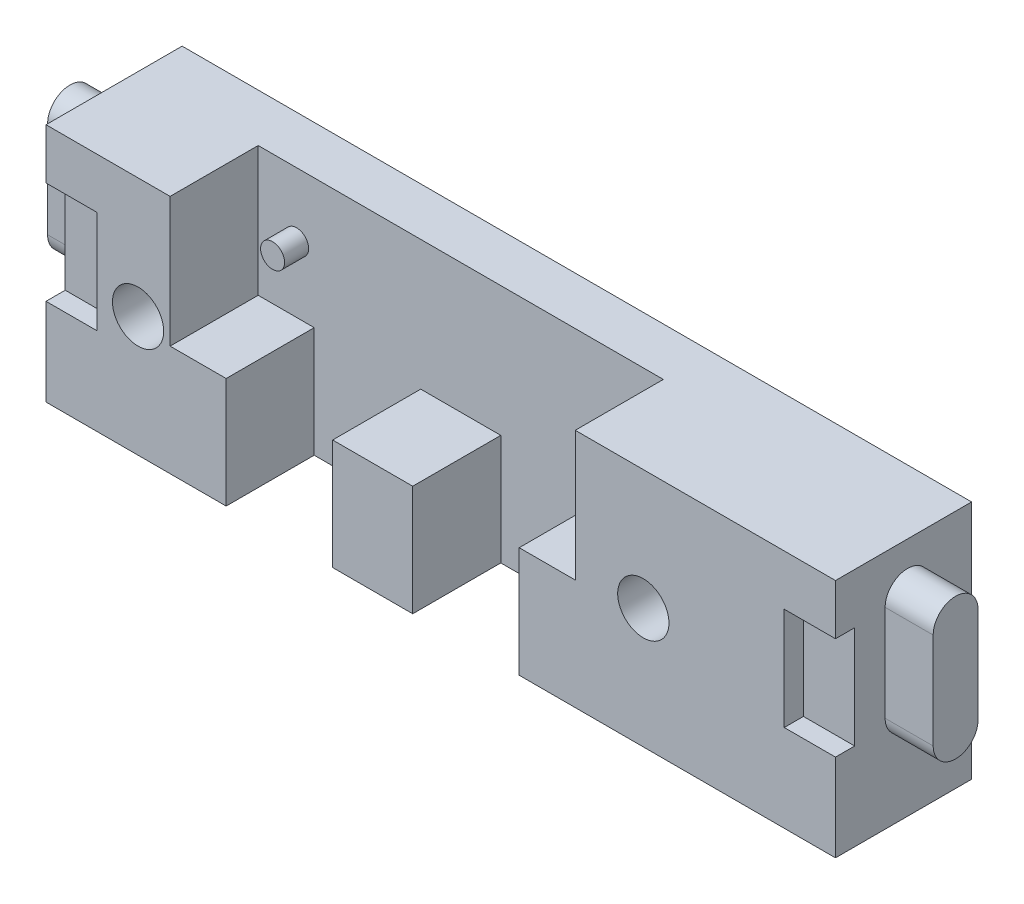
from build123d import *

# Parameters (mm, degrees)
SKETCH_1_W          = 49.3
SKETCH_1_H          = 15
EXTRUDE_1_DEPTH     = 3
SKETCH_2_W          = 5
SKETCH_2_H          = 4.567504656
SKETCH_2_H_2        = 2.332495344
EXTRUDE_2_DEPTH     = 5.5
SKETCH_3_R          = 0.75
EXTRUDE_3_DEPTH     = 1.5
SKETCH_4_R          = 1
CUT_EXTRUDE_1_DEPTH = 10
CUT_EXTRUDE_2_DEPTH = 4
EXTRUDE_4_DEPTH     = 3
SKETCH_9_R          = 1
EXTRUDE_5_DEPTH     = 4.5
EXTRUDE_9_DEPTH     = 4
SKETCH_8_R          = 1.6
CUT_EXTRUDE_3_DEPTH = 56.068502794
CUT_EXTRUDE_4_DEPTH = 2.3
SKETCH_13_W         = 3.2
SKETCH_13_H         = 6.4
CUT_EXTRUDE_5_DEPTH = 1.2


with BuildPart() as part:
    # 草图1 → 凸台-拉伸1 (new body)
    with BuildSketch(Plane.XY):
        with Locations((24.65, 7.5)):
            Rectangle(SKETCH_1_W, SKETCH_1_H)
    extrude(amount=EXTRUDE_1_DEPTH)

    # 草图2 → 凸台-拉伸2 (add)
    with BuildSketch(Plane.XY.offset(3)):
        Polygon((7.75, 6.9), (7.75, 15), (0, 15), (0, 0), (11.25, 0), (11.25, 6.9), align=None)
        with Locations((20.4, 2.283752328)):
            Rectangle(SKETCH_2_W, SKETCH_2_H)
        with Locations((20.4, 5.733752328)):
            Rectangle(SKETCH_2_W, SKETCH_2_H_2)
        Polygon((49.3, 15), (33.05, 15), (33.05, 6.9), (29.55, 6.9), (29.55, 0), (49.3, 0), align=None)
    extrude(amount=EXTRUDE_2_DEPTH)

    # 草图3 → 凸台-拉伸3 (add)
    with BuildSketch(Plane.XY.offset(3)):
        with Locations((10.15, 11)):
            Circle(SKETCH_3_R)
        with Locations((30.65, 11)):
            Circle(SKETCH_3_R)
    extrude(amount=EXTRUDE_3_DEPTH)

    # 草图4 → 切除-拉伸1 (cut)
    with BuildSketch(Plane.XY.offset(8.5)):
        with Locations((3.875, 7.5)):
            Circle(SKETCH_4_R)
        with Locations((41.175, 7.5)):
            Circle(SKETCH_4_R)
    extrude(amount=-CUT_EXTRUDE_1_DEPTH, mode=Mode.SUBTRACT)

    # 草图5 → 切除-拉伸2 (cut)
    with BuildSketch(Plane(origin=(0, 0, 0), x_dir=(-1, 0, 0), z_dir=(0, 0, -1))):
        Polygon((-5.000833025, 9.45), (-6.12666605, 7.5), (-5.000833025, 5.55), (-2.749166975, 5.55), (-1.62333395, 7.5), (-2.749166975, 9.45), align=None)
        Polygon((-42.300833025, 9.45), (-43.42666605, 7.5), (-42.300833025, 5.55), (-40.049166975, 5.55), (-38.92333395, 7.5), (-40.049166975, 9.45), align=None)
    extrude(amount=-CUT_EXTRUDE_2_DEPTH, mode=Mode.SUBTRACT)

    # 草图6 → 凸台-拉伸4 (add)
    with BuildSketch(Plane.ZY):
        with BuildLine():
            Line((2.6, 6), (2.6, 12))
            ThreePointArc((2.6, 12), (4, 13.4), (5.4, 12))
            Line((5.4, 12), (5.4, 6))
            ThreePointArc((5.4, 6), (4, 4.6), (2.6, 6))
        make_face()
    extrude_4 = extrude(amount=EXTRUDE_4_DEPTH)

    # 镜向1: 凸台-拉伸4 across plane
    add(extrude_4.mirror(Plane.ZY.offset(-24.65)))

    # 草图9 → 凸台-拉伸5 (add)
    with BuildSketch(Plane.XY.offset(8.5)):
        with Locations((41.175, 7.5)):
            Circle(SKETCH_9_R)
        with Locations((3.875, 7.5)):
            Circle(SKETCH_9_R)
    extrude(amount=-EXTRUDE_5_DEPTH)

    # 草图10 → 凸台-拉伸9 (add)
    with BuildSketch(Plane(origin=(0, 0, 0), x_dir=(-1, 0, 0), z_dir=(0, 0, -1))):
        Polygon((-2.749166975, 9.45), (-5.000833025, 9.45), (-6.12666605, 7.5), (-5.000833025, 5.55), (-2.749166975, 5.55), (-1.62333395, 7.5), align=None)
        Polygon((-40.049166975, 9.45), (-42.300833025, 9.45), (-43.42666605, 7.5), (-42.300833025, 5.55), (-40.049166975, 5.55), (-38.92333395, 7.5), align=None)
    extrude(amount=-EXTRUDE_9_DEPTH)

    # 草图8 → 切除-拉伸3 (cut, through all)
    with BuildSketch(Plane.XY.offset(8.5)):
        with Locations((5.75, 7.5)):
            Circle(SKETCH_8_R)
        with Locations((37.3, 7.5)):
            Circle(SKETCH_8_R)
    extrude(amount=-CUT_EXTRUDE_3_DEPTH, mode=Mode.SUBTRACT)

    # 草图11 → 切除-拉伸4 (cut)
    with BuildSketch(Plane(origin=(0, 0, 0), x_dir=(-1, 0, 0), z_dir=(0, 0, -1))):
        Polygon((-37.3, 10.617691454), (-40, 9.058845727), (-40, 5.941154273), (-37.3, 4.382308546), (-34.6, 5.941154273), (-34.6, 9.058845727), align=None)
        Polygon((-5.75, 10.617691454), (-8.45, 9.058845727), (-8.45, 5.941154273), (-5.75, 4.382308546), (-3.05, 5.941154273), (-3.05, 9.058845727), align=None)
    extrude(amount=-CUT_EXTRUDE_4_DEPTH, mode=Mode.SUBTRACT)

    # 草图13 → 切除-拉伸5 (cut)
    with BuildSketch(Plane.XY.offset(8.5)):
        with Locations((1.6, 8.65)):
            Rectangle(SKETCH_13_W, SKETCH_13_H)
    cut_extrude_5 = extrude(amount=-CUT_EXTRUDE_5_DEPTH, mode=Mode.SUBTRACT)

    # 镜向2: 切除-拉伸5 across plane
    add(cut_extrude_5.mirror(Plane.ZY.offset(-24.65)), mode=Mode.SUBTRACT)


solid = part.part
